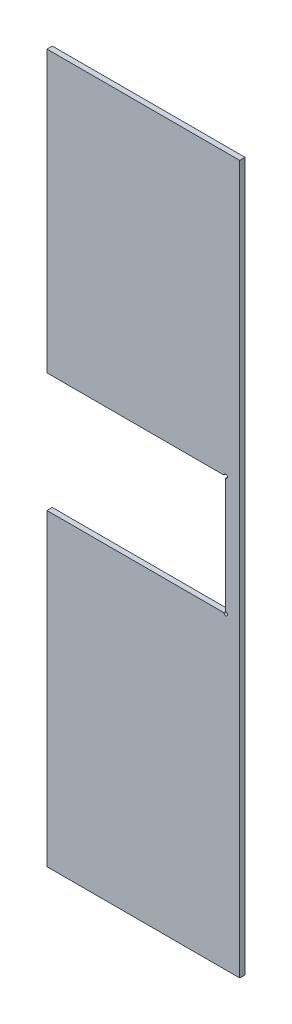
from build123d import *

# Parameters (mm, degrees)
BOSS_EXTRUDE1_DEPTH = 0.76
SKETCH2_R           = 0.25
CUT_EXTRUDE1_DEPTH  = 10


with BuildPart() as part:
    # Sketch1 → Boss-Extrude1 (new body)
    with BuildSketch(Plane.XY):
        Polygon((-13.75, -6.5), (11.75, -6.5), (11.75, 10.5), (-13.75, 10.5), (-13.75, 50.5), (13.75, 50.5), (13.75, -50.5), (-13.75, -50.5), align=None)
    extrude(amount=BOSS_EXTRUDE1_DEPTH)

    # Sketch2 → Cut-Extrude1 (cut)
    with BuildSketch(Plane.XY.offset(0.76)):
        with Locations((11.75, 10.5)):
            Circle(SKETCH2_R)
        with Locations((11.75, -6.5)):
            Circle(SKETCH2_R)
    extrude(amount=-CUT_EXTRUDE1_DEPTH, mode=Mode.SUBTRACT)


solid = part.part
